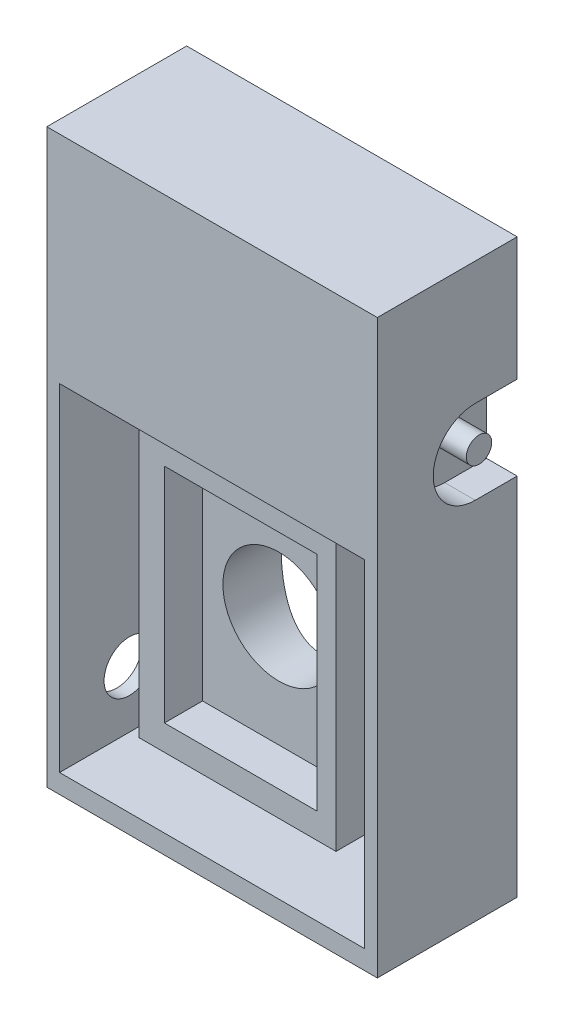
from build123d import *

# Parameters (mm, degrees)
SKETCH1_W           = 26
SKETCH1_H           = 45
BOSS_EXTRUDE1_DEPTH = 11
SKETCH2_R           = 8.45
CUT_EXTRUDE1_DEPTH  = 28
CUT_EXTRUDE2_DEPTH  = 26.5
BOSS_EXTRUDE2_START = 23
BOSS_EXTRUDE2_DEPTH = 23
SKETCH6_W           = 12
SKETCH6_H           = 17.5
CUT_EXTRUDE3_DEPTH  = 3
SKETCH7_R           = 4.4
CUT_EXTRUDE4_DEPTH  = 53.316345438
SKETCH8_R           = 2
CUT_EXTRUDE5_DEPTH  = 3
SKETCH9_R           = 1
CUT_EXTRUDE6_DEPTH  = 2.4
CUT_EXTRUDE7_START  = -2.4
SKETCH10_R          = 1
CUT_EXTRUDE7_DEPTH  = 2.4


with BuildPart() as part:
    # Sketch1 → Boss-Extrude1 (new body)
    with BuildSketch(Plane.XY):
        with Locations((13, -22.5)):
            Rectangle(SKETCH1_W, SKETCH1_H)
    extrude(amount=BOSS_EXTRUDE1_DEPTH)

    # Sketch2 → Cut-Extrude1 (cut)
    with BuildSketch(Plane.XZ.offset(45)):
        with Locations((13, -5.95)):
            Circle(SKETCH2_R)
    extrude(amount=-CUT_EXTRUDE1_DEPTH, mode=Mode.SUBTRACT)

    # Sketch4 → Cut-Extrude2 (cut)
    with BuildSketch(Plane(origin=(0, -43.5, 0), x_dir=(-1, 0, 0), z_dir=(0, -1, 0))):
        with BuildLine():
            Line((-1, -11), (-1, -1))
            Line((-1, -1), (-6.596875763, -1))
            ThreePointArc((-6.596875763, -1), (-13, -3.5), (-19.403124237, -1))
            Line((-19.403124237, -1), (-25, -1))
            Line((-25, -1), (-25, -11))
            Line((-25, -11), (-1, -11))
        make_face()
    extrude(amount=-CUT_EXTRUDE2_DEPTH, mode=Mode.SUBTRACT)

    # Sketch5 → Boss-Extrude2 (add)
    with BuildSketch(Plane.XZ.offset(17).offset(BOSS_EXTRUDE2_START)):
        with BuildLine():
            Line((6.596875763, 1), (5.25, 1))
            Line((5.25, 1), (5.25, 9))
            Line((5.25, 9), (20.75, 9))
            Line((20.75, 9), (20.75, 1))
            Line((20.75, 1), (19.403124237, 1))
            ThreePointArc((19.403124237, 1), (13, 3.5), (6.596875763, 1))
        make_face()
    extrude(amount=-BOSS_EXTRUDE2_DEPTH)

    # Sketch6 → Cut-Extrude3 (cut)
    with BuildSketch(Plane.XY.offset(9)):
        with Locations((13.25, -29.25)):
            Rectangle(SKETCH6_W, SKETCH6_H)
    extrude(amount=-CUT_EXTRUDE3_DEPTH, mode=Mode.SUBTRACT)

    # Sketch7 → Cut-Extrude4 (cut, through all)
    with BuildSketch(Plane.XY.offset(6)):
        with Locations((13.25, -29.25)):
            Circle(SKETCH7_R)
    extrude(amount=-CUT_EXTRUDE4_DEPTH, mode=Mode.SUBTRACT)

    # Sketch8 → Cut-Extrude5 (cut)
    with BuildSketch(Plane.ZY):
        with Locations(Location((5.5, -39, 0), (0, 0, 270))):
            Circle(SKETCH8_R)
    extrude(amount=-CUT_EXTRUDE5_DEPTH, mode=Mode.SUBTRACT)

    # Sketch9 → Cut-Extrude6 (cut)
    with BuildSketch(Plane.ZY):
        with BuildLine():
            Line((0, -16.3), (3.3, -16.3))
            ThreePointArc((3.3, -16.3), (6.6, -13), (3.3, -9.7))
            Line((3.3, -9.7), (0, -9.7))
            Line((0, -9.7), (0, -16.3))
        make_face()
        with Locations(Location((3, -13, 0), (0, 0, 270))):
            Circle(SKETCH9_R, mode=Mode.SUBTRACT)
    extrude(amount=-CUT_EXTRUDE6_DEPTH, mode=Mode.SUBTRACT)

    # Sketch10 → Cut-Extrude7 (cut)
    with BuildSketch(Plane(origin=(26, 0, 0), x_dir=(0, 0, -1), z_dir=(1, 0, 0)).offset(CUT_EXTRUDE7_START)):
        with BuildLine():
            Line((0, -16.3), (0, -9.7))
            Line((0, -9.7), (-3.3, -9.7))
            ThreePointArc((-3.3, -9.7), (-6.6, -13), (-3.3, -16.3))
            Line((-3.3, -16.3), (0, -16.3))
        make_face()
        with Locations(Location((-3, -13, 0), (0, 0, 270))):
            Circle(SKETCH10_R, mode=Mode.SUBTRACT)
    extrude(amount=CUT_EXTRUDE7_DEPTH, mode=Mode.SUBTRACT)


solid = part.part
